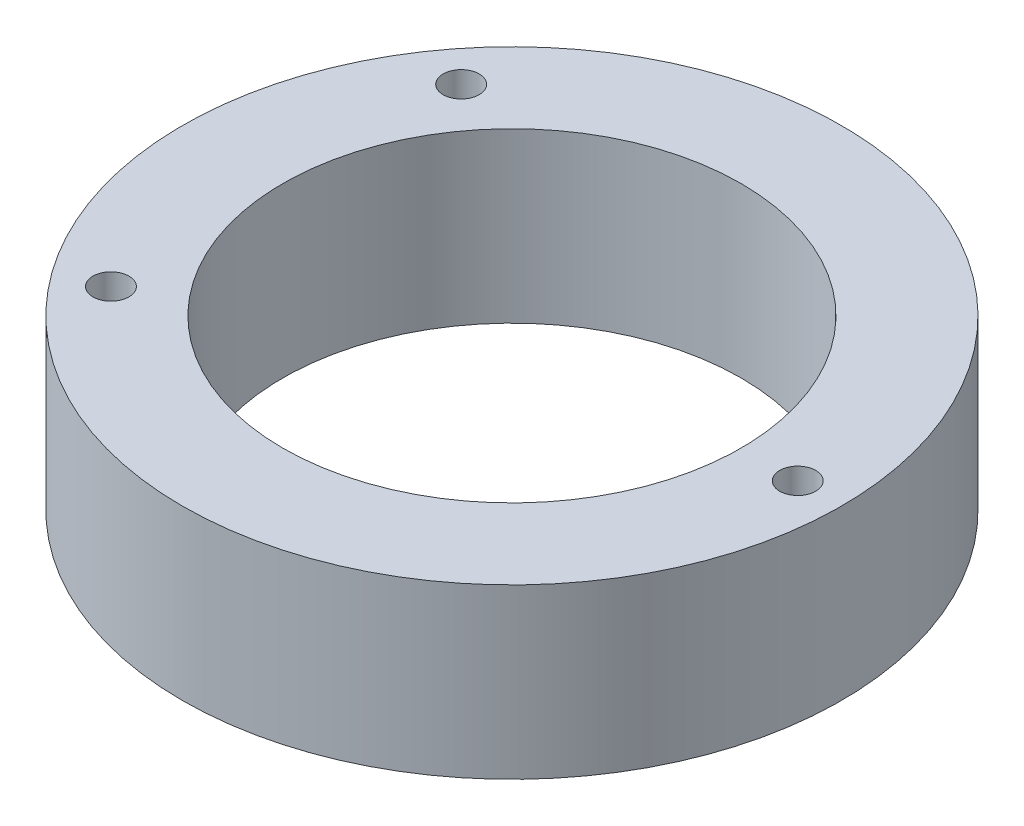
from build123d import *

# Parameters (mm, degrees)
BOSS_EXTRUDE1_DEPTH      = 13
BOSS_EXTRUDE1_DEPTH_BACK = 3.35
SKETCH1_R                = 32
SKETCH1_R_2              = 22.25
SKETCH1_R_3              = 1.75


with BuildPart() as part:
    # Sketch1 → Boss-Extrude1 (new, two sides: drawn at the far end of the back side and taken through both)
    with BuildSketch(Plane(origin=(0, 0, 0), x_dir=(1, 0, 0), z_dir=(0, 1, 0)).offset(-BOSS_EXTRUDE1_DEPTH_BACK)):
        with Locations(Location((0, 0, 0), (0, 0, 270))):
            Circle(SKETCH1_R)
        with Locations(Location((0, 0, 0), (0, 0, 270))):
            Circle(SKETCH1_R_2, mode=Mode.SUBTRACT)
        with Locations(Location((27.75, 0, 0), (0, 0, 270))):
            Circle(SKETCH1_R_3, mode=Mode.SUBTRACT)
        with Locations(Location((-21.931253571, 17.002429733, 0), (0, 0, 270))):
            Circle(SKETCH1_R_3, mode=Mode.SUBTRACT)
        with Locations(Location((-21.931253571, -17.002429733, 0), (0, 0, 270))):
            Circle(SKETCH1_R_3, mode=Mode.SUBTRACT)
    extrude(amount=BOSS_EXTRUDE1_DEPTH + BOSS_EXTRUDE1_DEPTH_BACK)


solid = part.part
